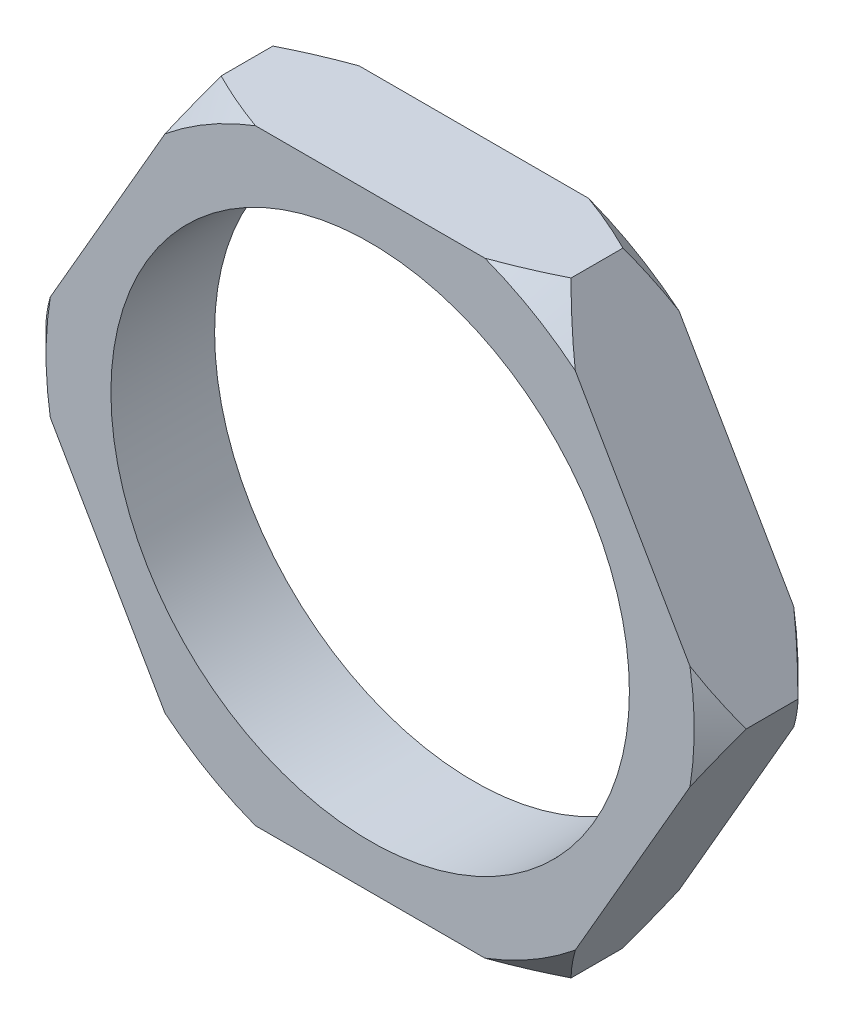
from build123d import *

# Parameters (mm, degrees)
SKETCH1_R           = 10
BOSS_EXTRUDE1_DEPTH = 2


with BuildPart() as part:
    # Sketch1 → Boss-Extrude1 (new, symmetric)
    with BuildSketch(Plane.XY):
        Polygon((6.75, -11.691342951), (13.5, 0), (6.75, 11.691342951), (-6.75, 11.691342951), (-13.5, 0), (-6.75, -11.691342951), align=None)
        Circle(SKETCH1_R, mode=Mode.SUBTRACT)
    extrude(amount=BOSS_EXTRUDE1_DEPTH, both=True)

    # Sketch4 → Cut-Revolve1 (revolve, cut)
    with BuildSketch(Plane(origin=(0, 0, 0), x_dir=(1, 0, 0), z_dir=(0, 1, 0))):
        Polygon((-13.5, 2), (-12.5, 2), (-13.5, 1), align=None)
    cut_revolve1 = revolve(axis=Axis((0, 0, -2), (0, 0, 1)), mode=Mode.SUBTRACT)

    # Mirror1: Cut-Revolve1 across plane
    add(cut_revolve1.mirror(Plane.XY), mode=Mode.SUBTRACT)


solid = part.part
